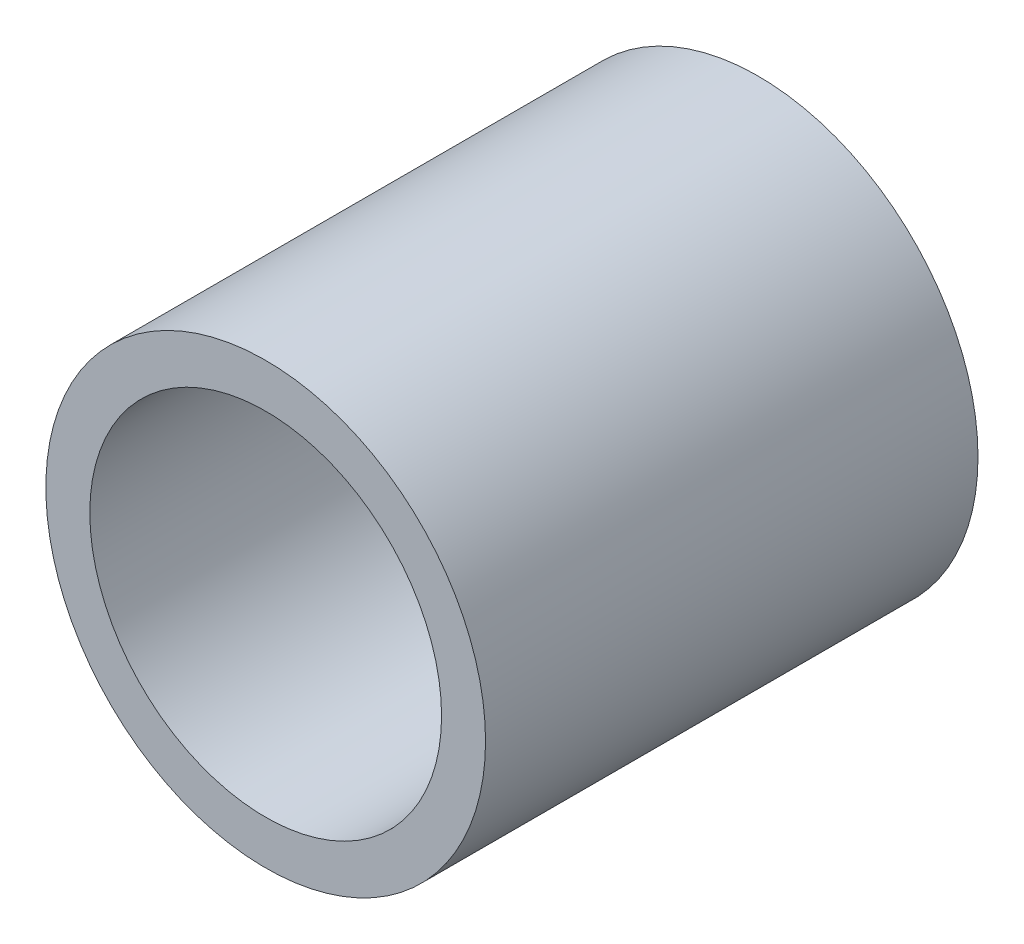
from build123d import *

# Parameters (mm, degrees)
SKETCH1_R      = 1.25
SKETCH1_R_2    = 1
EXTRUDE1_DEPTH = 2.8


with BuildPart() as part:
    # Sketch1 → Extrude1 (new body)
    with BuildSketch(Plane.XY):
        Circle(SKETCH1_R)
        Circle(SKETCH1_R_2, mode=Mode.SUBTRACT)
    extrude(amount=-EXTRUDE1_DEPTH)


solid = part.part
